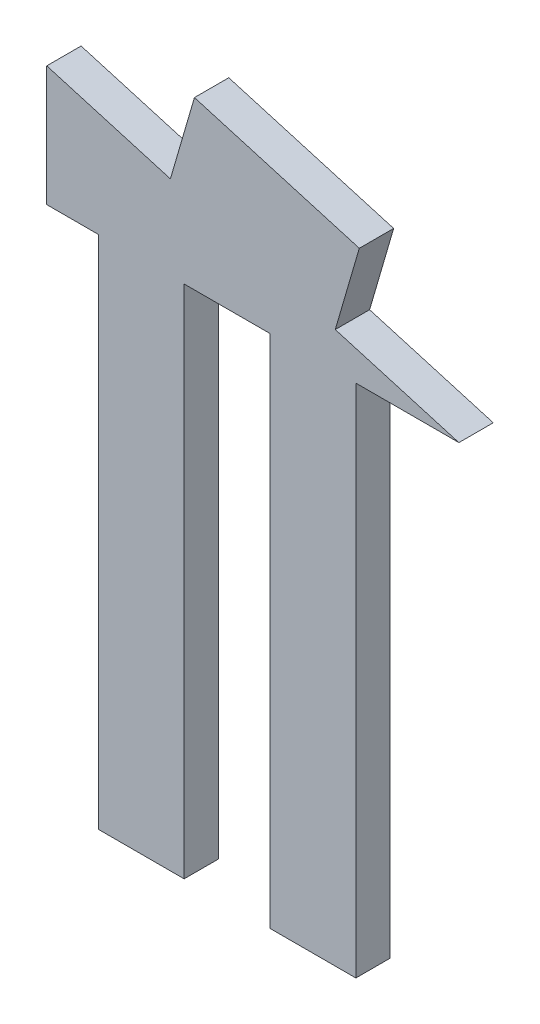
from build123d import *

# Parameters (mm, degrees)
SKETCH1_W           = 5
SKETCH1_H           = 100
BOSS_EXTRUDE1_DEPTH = 2
SKETCH2_W           = 5
SKETCH2_H           = 2
CUT_EXTRUDE1_DEPTH  = 50
SKETCH3_W           = 5
SKETCH3_H           = 2
CUT_EXTRUDE2_DEPTH  = 20


with BuildPart() as part:
    # Sketch1 → Boss-Extrude1 (new body)
    with BuildSketch(Plane.XY):
        with Locations((5.5, -50)):
            Rectangle(SKETCH1_W, SKETCH1_H)
        with Locations((15.5, -50)):
            Rectangle(SKETCH1_W, SKETCH1_H)
        Polygon((24, 0), (0, 7), (0, 0), align=None)
        Polygon((8.6, 9.7), (18.2, 6.9), (16.8, 2.1), (7.2, 4.9), align=None)
    extrude(amount=BOSS_EXTRUDE1_DEPTH)

    # Sketch2 → Cut-Extrude1 (cut)
    with BuildSketch(Plane.XZ.offset(100)):
        with Locations((5.5, 1)):
            Rectangle(SKETCH2_W, SKETCH2_H)
        with Locations((15.5, 1)):
            Rectangle(SKETCH2_W, SKETCH2_H)
    extrude(amount=-CUT_EXTRUDE1_DEPTH, mode=Mode.SUBTRACT)

    # Sketch3 → Cut-Extrude2 (cut)
    with BuildSketch(Plane(origin=(0, -50, 0), x_dir=(-1, 0, 0), z_dir=(0, -1, 0))):
        with Locations((-5.5, -1)):
            Rectangle(SKETCH3_W, SKETCH3_H)
        with Locations((-15.5, -1)):
            Rectangle(SKETCH3_W, SKETCH3_H)
    extrude(amount=-CUT_EXTRUDE2_DEPTH, mode=Mode.SUBTRACT)


solid = part.part
